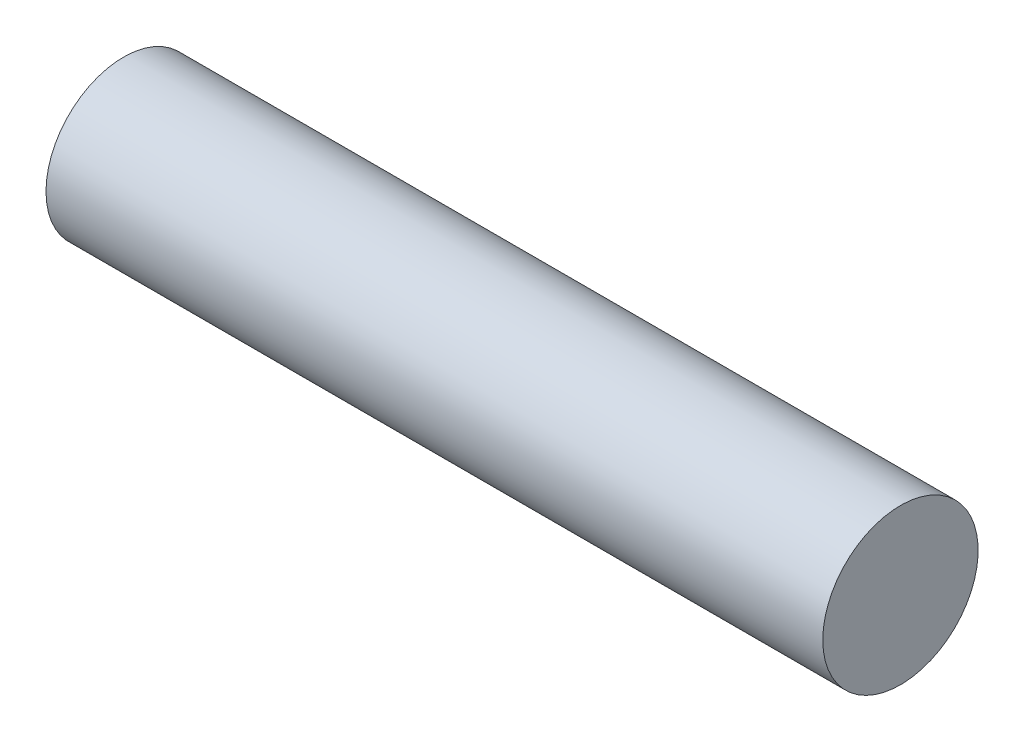
from build123d import *

# Parameters (mm, degrees)
ESQUISSE1_W = 300
ESQUISSE1_H = 30


with BuildPart() as part:
    # Esquisse1 → Révolution1 (revolve)
    with BuildSketch(Plane.XY, mode=Mode.PRIVATE) as r_volution1_sk:
        with Locations((150, 15)):
            Rectangle(ESQUISSE1_W, ESQUISSE1_H)
    revolve(r_volution1_sk.sketch.rotate(Axis((0, 0, 0), (1, 0, 0)), 90), axis=Axis((0, 0, 0), (1, 0, 0)))


solid = part.part
